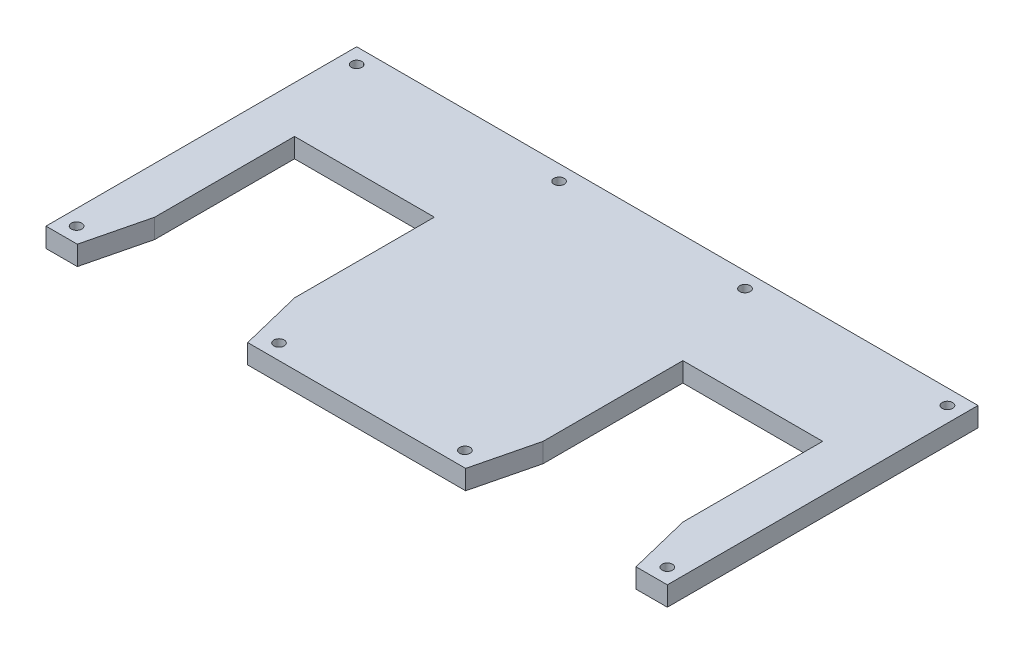
from build123d import *

# Parameters (mm, degrees)
BOSS_EXTRUDE1_DEPTH = 6.35
SKETCH2_R           = 1.7
CUT_EXTRUDE1_DEPTH  = 128.158650905
SKETCH3_W           = 101.6
SKETCH3_H           = 6.35
BOSS_EXTRUDE2_DEPTH = 50.8


with BuildPart() as part:
    # Sketch1 → Boss-Extrude1 (new body)
    with BuildSketch(Plane(origin=(0, 0, 0), x_dir=(1, 0, 0), z_dir=(0, 1, 0))):
        Polygon((15.24, 20.32), (15.24, 66.04), (60.96, 66.04), (60.96, 20.32), (65.96, 0), (76.2, 0), (76.2, 101.6), (0, 101.6), (0, 0), (10.24, 0), align=None)
    extrude(amount=BOSS_EXTRUDE1_DEPTH)

    # Sketch2 → Cut-Extrude1 (cut, through all)
    with BuildSketch(Plane(origin=(0, 6.35, 0), x_dir=(1, 0, 0), z_dir=(0, 1, 0))):
        with Locations(Location((5, 96.6, 0), (0, 0, 270))):
            Circle(SKETCH2_R)
        with Locations(Location((71.2, 96.6, 0), (0, 0, 90))):
            Circle(SKETCH2_R)
        with Locations(Location((71.2, 5, 0), (0, 0, 270))):
            Circle(SKETCH2_R)
        with Locations(Location((5, 5, 0), (0, 0, 90))):
            Circle(SKETCH2_R)
    extrude(amount=-CUT_EXTRUDE1_DEPTH, mode=Mode.SUBTRACT)


with BuildPart() as body_2:
    # Mirror1: mirrored copy
    add(part.part.mirror(Plane.ZY.offset(25.4)))


with BuildPart() as part_1:
    add(part.part)

    add(body_2.part)  # Boss-Extrude2 merges body 2
    # Sketch3 → Boss-Extrude2 (add)
    with BuildSketch(Plane(origin=(-50.8, 0, 0), x_dir=(0, 0, -1), z_dir=(1, 0, 0))):
        with Locations((50.8, 3.175)):
            Rectangle(SKETCH3_W, SKETCH3_H)
    extrude(amount=BOSS_EXTRUDE2_DEPTH)


solid = part_1.part
